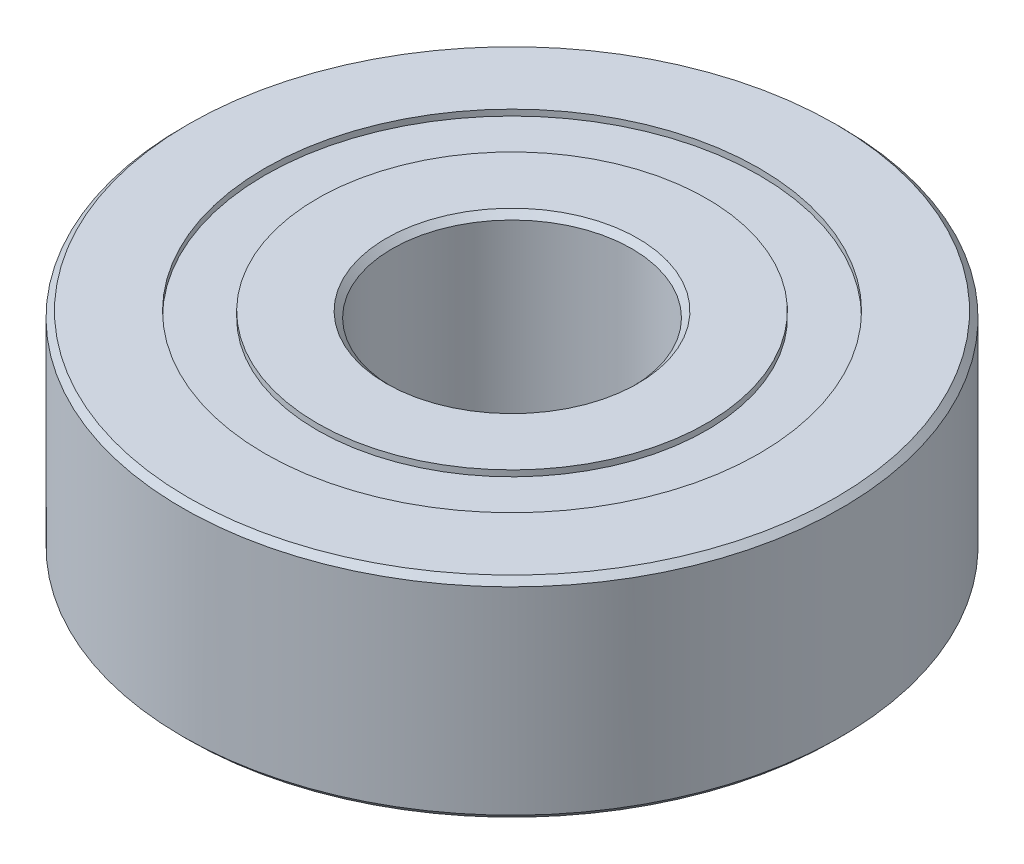
from build123d import *

# Parameters (mm, degrees)
SKETCH1_R           = 11
SKETCH1_R_2         = 4
BOSS_EXTRUDE1_DEPTH = 7
SKETCH2_R           = 8.25
SKETCH2_R_2         = 6.5
CUT_EXTRUDE1_DEPTH  = 0.2
CUT_EXTRUDE2_START  = -0.2
SKETCH3_R           = 8.25
SKETCH3_R_2         = 6.5
CUT_EXTRUDE2_DEPTH  = 0.2
CHAMFER1_SIZE       = 0.2


with BuildPart() as part:
    # Sketch1 → Boss-Extrude1 (new body)
    with BuildSketch(Plane(origin=(0, 0, 0), x_dir=(1, 0, 0), z_dir=(0, 1, 0))):
        with Locations(Location((0, 0, 0), (0, 0, 270))):
            Circle(SKETCH1_R)
        with Locations(Location((0, 0, 0), (0, 0, 270))):
            Circle(SKETCH1_R_2, mode=Mode.SUBTRACT)
    extrude(amount=BOSS_EXTRUDE1_DEPTH)

    # Sketch2 → Cut-Extrude1 (cut)
    with BuildSketch(Plane(origin=(0, 7, 0), x_dir=(1, 0, 0), z_dir=(0, 1, 0))):
        with Locations(Location((0, 0, 0), (0, 0, 270))):
            Circle(SKETCH2_R)
        with Locations(Location((0, 0, 0), (0, 0, 270))):
            Circle(SKETCH2_R_2, mode=Mode.SUBTRACT)
    extrude(amount=-CUT_EXTRUDE1_DEPTH, mode=Mode.SUBTRACT)

    # Sketch3 → Cut-Extrude2 (cut)
    with BuildSketch(Plane.XZ.offset(CUT_EXTRUDE2_START)):
        with Locations(Location((0, 0, 0), (0, 0, 90))):
            Circle(SKETCH3_R)
        with Locations(Location((0, 0, 0), (0, 0, 90))):
            Circle(SKETCH3_R_2, mode=Mode.SUBTRACT)
    extrude(amount=CUT_EXTRUDE2_DEPTH, mode=Mode.SUBTRACT)

    # Chamfer1
    chamfer1_edges = [part.edges().sort_by_distance(p)[0] for p in [
        (0, 0, -11),
        (0, 7, -11),
        (0, 0, -4),
        (0, 7, -4),
    ]]
    chamfer(chamfer1_edges, length=CHAMFER1_SIZE)


solid = part.part
